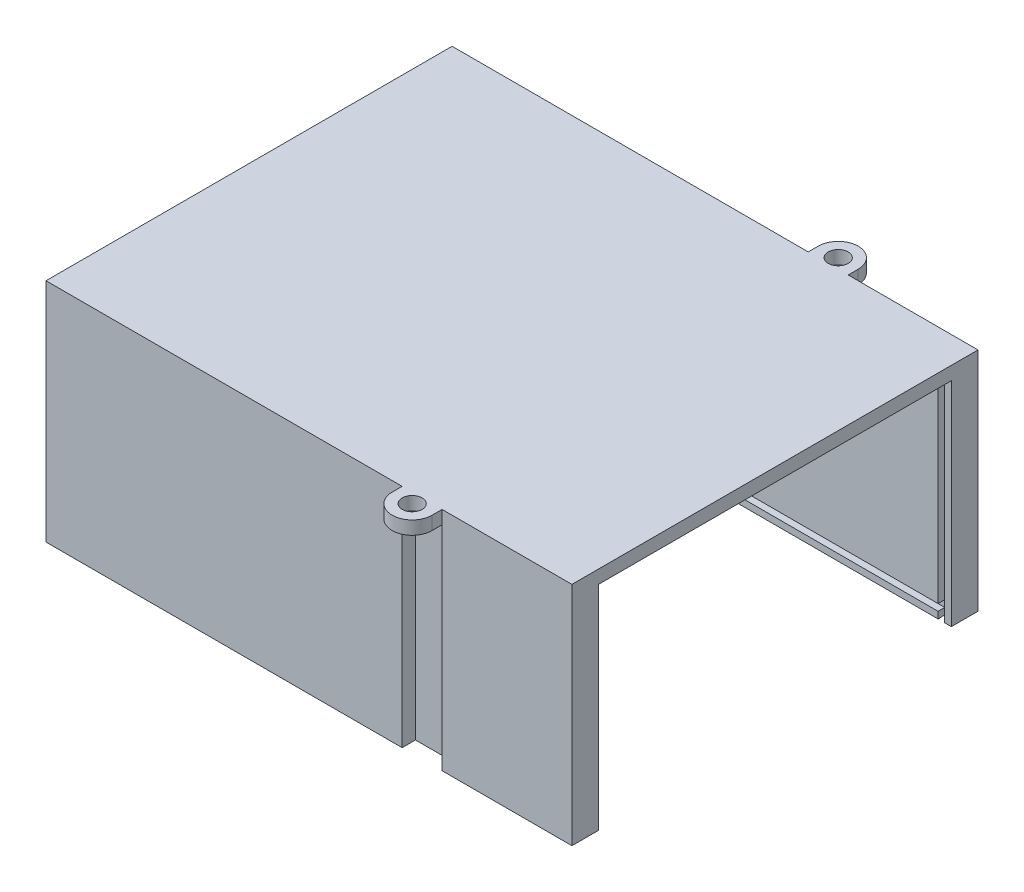
from build123d import *

# Parameters (mm, degrees)
SKETCH_1_W               = 79
SKETCH_1_H               = 57
SKETCH_1_W_2             = 71
SKETCH_1_H_2             = 49
SKETCH_1_R               = 1.5
EXTRUDE_1_DEPTH          = 2
SKETCH_2_W               = 79
SKETCH_2_H               = 2
EXTRUDE_2_DEPTH          = 32
CUT_EXTRUDE_1_DEPTH      = 1
CUT_EXTRUDE_1_DEPTH_BACK = 62.719121834
SKETCH_3_W               = 1
SKETCH_3_H               = 55
CUT_EXTRUDE_2_DEPTH      = 37.5
CUT_EXTRUDE_2_DEPTH_BACK = 62.719121834
SKETCH_4_W               = 1
SKETCH_4_H               = 1
EXTRUDE_3_DEPTH          = 2
EXTRUDE_3_DEPTH_BACK     = 32
SKETCH_5_W               = 53.5
SKETCH_5_H               = 2
SKETCH_5_W_2             = 19.5


with BuildPart() as part:
    # 草图1 → 凸台-拉伸1 (new body)
    # profile 1 of 4: a face of its own
    with BuildSketch(Plane(origin=(0, 0, 0), x_dir=(1, 0, 0), z_dir=(0, 1, 0))):
        Rectangle(SKETCH_1_W, SKETCH_1_H)
        Rectangle(SKETCH_1_W_2, SKETCH_1_H_2, mode=Mode.SUBTRACT)
    # profile 2 of 4: a face of its own
    with BuildSketch(Plane(origin=(0, 0, 0), x_dir=(1, 0, 0), z_dir=(0, 1, 0))):
        Rectangle(SKETCH_1_W_2, SKETCH_1_H_2)
    # profile 3 of 4: a face of its own
    with BuildSketch(Plane(origin=(0, 0, 0), x_dir=(1, 0, 0), z_dir=(0, 1, 0))):
        with BuildLine():
            Line((20, -28.5), (14, -28.5))
            Line((14, -28.5), (14, -32))
            ThreePointArc((14, -32), (17, -35), (20, -32))
            Line((20, -32), (20, -28.5))
        make_face()
        with Locations(Location((17, -32, 0), (0, 0, 270))):
            Circle(SKETCH_1_R, mode=Mode.SUBTRACT)
    # profile 4 of 4: a face of its own
    with BuildSketch(Plane(origin=(0, 0, 0), x_dir=(1, 0, 0), z_dir=(0, 1, 0))):
        with BuildLine():
            Line((14, 32), (14, 28.5))
            Line((14, 28.5), (20, 28.5))
            Line((20, 28.5), (20, 32))
            ThreePointArc((20, 32), (17, 35), (14, 32))
        make_face()
        with Locations(Location((17, 32, 0), (0, 0, 270))):
            Circle(SKETCH_1_R, mode=Mode.SUBTRACT)
    extrude(amount=EXTRUDE_1_DEPTH)

    # 草图2 → 凸台-拉伸2 (add)
    with BuildSketch(Plane(origin=(0, 0, 0), x_dir=(1, 0, 0), z_dir=(0, 1, 0))):
        with Locations((0, 27.5)):
            Rectangle(SKETCH_2_W, SKETCH_2_H)
        with Locations((0, -27.5)):
            Rectangle(SKETCH_2_W, SKETCH_2_H)
    extrude(amount=-EXTRUDE_2_DEPTH)

    # 草图3 → 切除-拉伸1 (cut, two sides: drawn at the far end of the back side and taken through both)
    with BuildSketch(Plane(origin=(0, 0, 0), x_dir=(1, 0, 0), z_dir=(0, 1, 0)).offset(-CUT_EXTRUDE_1_DEPTH_BACK)):
        with Locations((38, 0)):
            Rectangle(SKETCH_3_W, SKETCH_3_H)
    extrude(amount=CUT_EXTRUDE_1_DEPTH + CUT_EXTRUDE_1_DEPTH_BACK, mode=Mode.SUBTRACT)

    # 草图4 → 切除-拉伸2 (cut, two sides: drawn at the far end of the back side and taken through both)
    with BuildSketch(Plane(origin=(0, 0, 0), x_dir=(0, 0, -1), z_dir=(1, 0, 0)).offset(-CUT_EXTRUDE_2_DEPTH_BACK)):
        with Locations((-27, -30.5)):
            Rectangle(SKETCH_4_W, SKETCH_4_H)
        with Locations((27, -30.5)):
            Rectangle(SKETCH_4_W, SKETCH_4_H)
    extrude(amount=CUT_EXTRUDE_2_DEPTH + CUT_EXTRUDE_2_DEPTH_BACK, mode=Mode.SUBTRACT)

    # 草图5 → 凸台-拉伸3 (add, two sides: drawn at the far end of the back side and taken through both)
    with BuildSketch(Plane(origin=(0, 0, 0), x_dir=(1, 0, 0), z_dir=(0, 1, 0)).offset(-EXTRUDE_3_DEPTH_BACK)):
        with Locations((-12.75, 29.5)):
            Rectangle(SKETCH_5_W, SKETCH_5_H)
        with Locations((-12.75, -29.5)):
            Rectangle(SKETCH_5_W, SKETCH_5_H)
        with Locations((29.75, 29.5)):
            Rectangle(SKETCH_5_W_2, SKETCH_5_H)
        with Locations((29.75, -29.5)):
            Rectangle(SKETCH_5_W_2, SKETCH_5_H)
    extrude(amount=EXTRUDE_3_DEPTH + EXTRUDE_3_DEPTH_BACK)


solid = part.part
